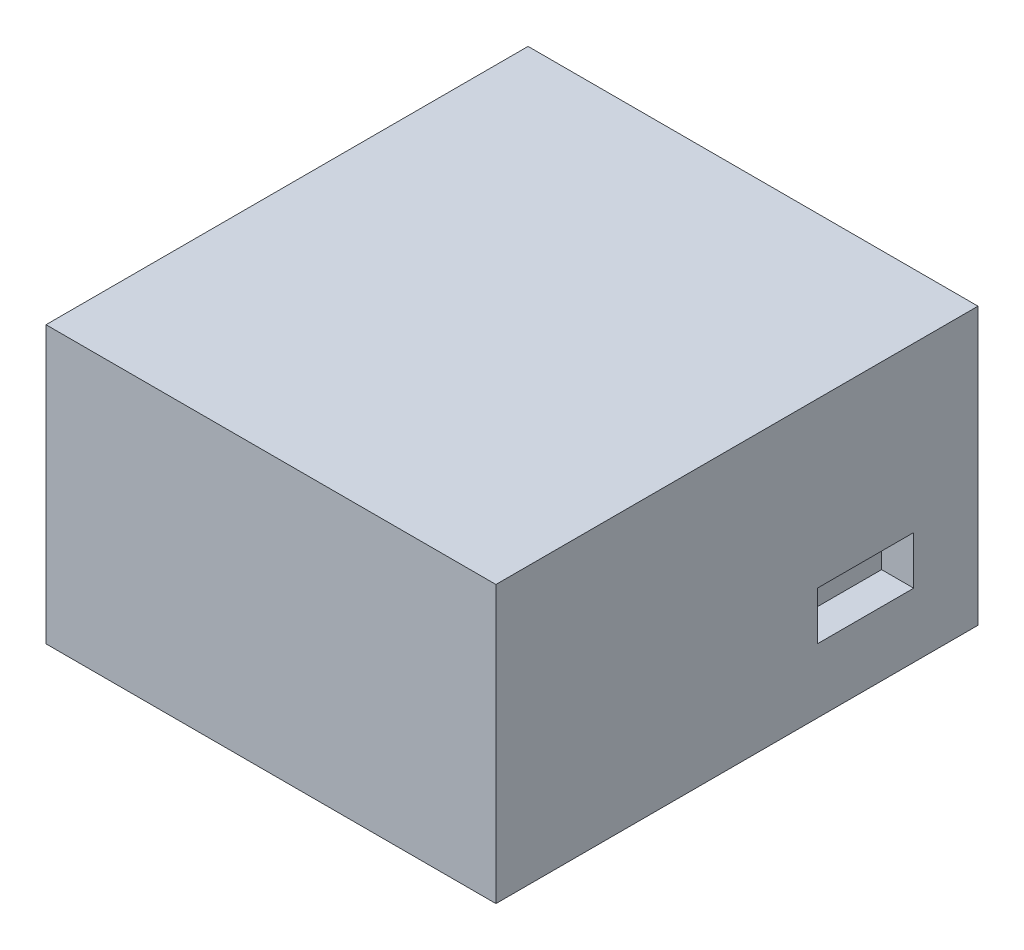
from build123d import *

# Parameters (mm, degrees)
CROQUIS1_W              = 140
CROQUIS1_H              = 150
SALIENTE_EXTRUIR1_DEPTH = 86
CROQUIS3_W              = 30
CROQUIS3_H              = 15
CORTAR_EXTRUIR1_DEPTH   = 10


with BuildPart() as part:
    # Croquis1 → Saliente-Extruir1 (new body)
    with BuildSketch(Plane(origin=(0, 0, 0), x_dir=(1, 0, 0), z_dir=(0, 1, 0))):
        Rectangle(CROQUIS1_W, CROQUIS1_H)
    extrude(amount=SALIENTE_EXTRUIR1_DEPTH)

    # Croquis3 → Cortar-Extruir1 (cut)
    with BuildSketch(Plane(origin=(70, 0, 0), x_dir=(0, 0, -1), z_dir=(1, 0, 0))):
        with Locations((40, 27.5)):
            Rectangle(CROQUIS3_W, CROQUIS3_H)
    extrude(amount=-CORTAR_EXTRUIR1_DEPTH, mode=Mode.SUBTRACT)


solid = part.part
